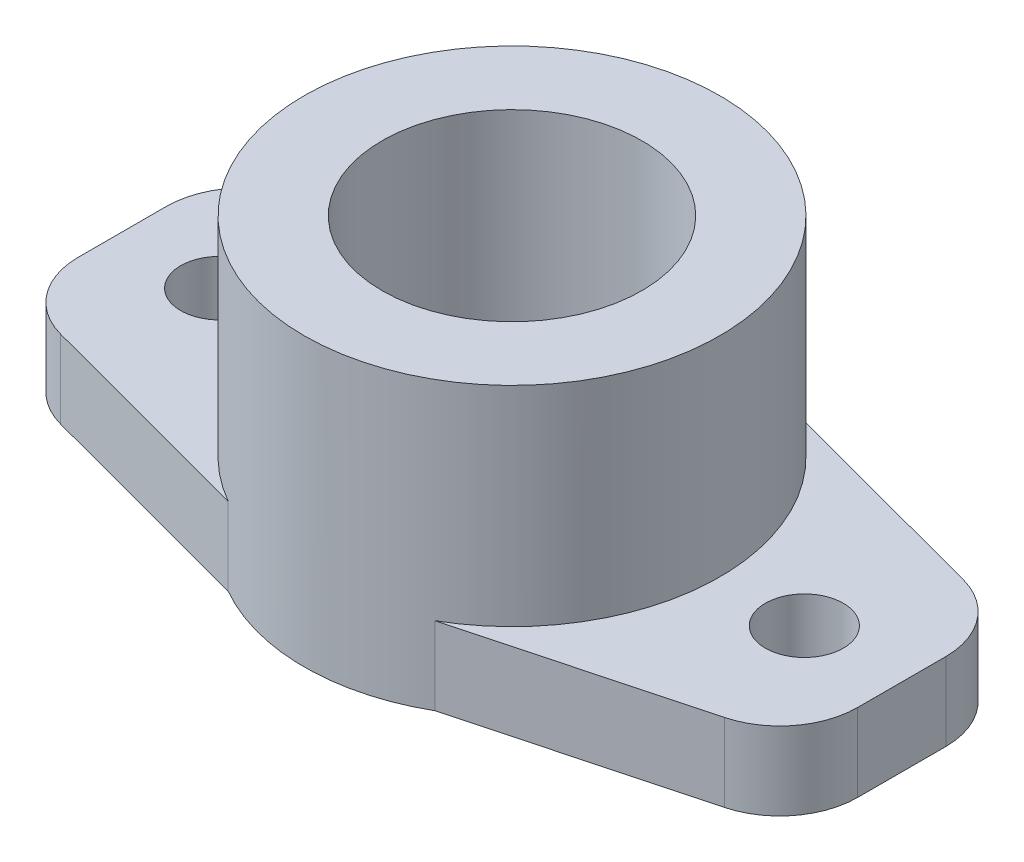
from build123d import *

# Parameters (mm, degrees)
SKETCH2_R           = 5
SKETCH2_R_2         = 1.5
BOSS_EXTRUDE1_DEPTH = 3
FILLET1_R           = 3
SKETCH3_R           = 8
SKETCH3_R_2         = 5
BOSS_EXTRUDE2_DEPTH = 8.04


with BuildPart() as part:
    # Sketch2 → Boss-Extrude1 (new body)
    with BuildSketch(Plane(origin=(0, 0, 0), x_dir=(1, 0, 0), z_dir=(0, 1, 0))):
        with BuildLine():
            Line((30, 4), (30, 12))
            Line((30, 12), (18.98340249, 14.937759336))
            ThreePointArc((18.98340249, 14.937759336), (15, 16), (11.01659751, 14.937759336))
            Line((11.01659751, 14.937759336), (0, 12))
            Line((0, 12), (0, 4))
            Line((0, 4), (11.01659751, 1.062240664))
            ThreePointArc((11.01659751, 1.062240664), (15, 0), (18.98340249, 1.062240664))
            Line((18.98340249, 1.062240664), (30, 4))
        make_face()
        with Locations(Location((15, 8, 0), (0, 0, 270))):
            Circle(SKETCH2_R, mode=Mode.SUBTRACT)
        with Locations(Location((26.25, 8, 0), (0, 0, 270))):
            Circle(SKETCH2_R_2, mode=Mode.SUBTRACT)
        with Locations(Location((3.75, 8, 0), (0, 0, 90))):
            Circle(SKETCH2_R_2, mode=Mode.SUBTRACT)
    extrude(amount=BOSS_EXTRUDE1_DEPTH)

    # Fillet1
    fillet1_edges = [part.edges().sort_by_distance(p)[0] for p in [
        (0, 1.5, -4),
        (0, 1.5, -12),
        (30, 1.5, -12),
        (30, 1.5, -4),
    ]]
    fillet(fillet1_edges, radius=FILLET1_R)

    # Sketch3 → Boss-Extrude2 (add)
    with BuildSketch(Plane(origin=(0, 3, 0), x_dir=(1, 0, 0), z_dir=(0, 1, 0))):
        with Locations(Location((15, 8, 0), (0, 0, 60.137165644))):
            Circle(SKETCH3_R)
        with Locations(Location((15, 8, 0), (0, 0, 270))):
            Circle(SKETCH3_R_2, mode=Mode.SUBTRACT)
    extrude(amount=BOSS_EXTRUDE2_DEPTH)


solid = part.part
